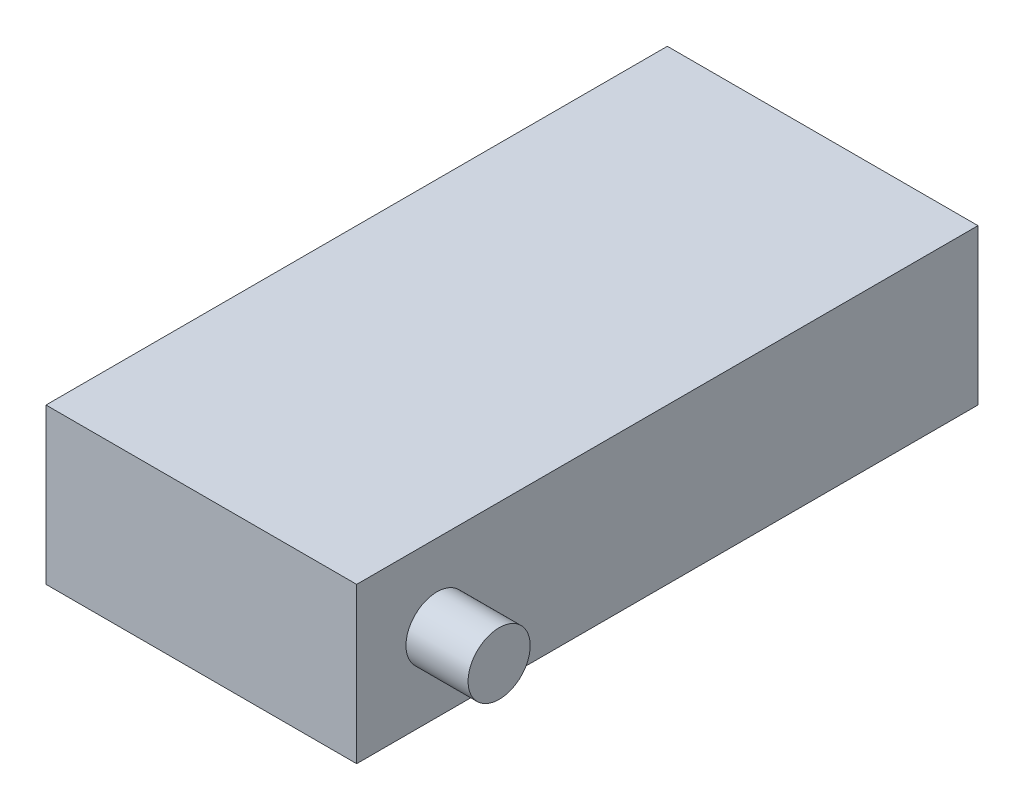
from build123d import *

# Parameters (mm, degrees)
SKETCH1_W           = 40
SKETCH1_H           = 10
BOSS_EXTRUDE1_DEPTH = 20
SKETCH2_R           = 2
BOSS_EXTRUDE2_DEPTH = 4


with BuildPart() as part:
    # Sketch1 → Boss-Extrude1 (new body)
    with BuildSketch(Plane(origin=(0, 0, 0), x_dir=(0, 0, -1), z_dir=(1, 0, 0))):
        with Locations((6.382595331, 3.446369028)):
            Rectangle(SKETCH1_W, SKETCH1_H)
    extrude(amount=BOSS_EXTRUDE1_DEPTH)

    # Sketch2 → Boss-Extrude2 (add)
    with BuildSketch(Plane(origin=(20, 0, 0), x_dir=(0, 0, -1), z_dir=(1, 0, 0))):
        with Locations((-8.44508687, 3.446369028)):
            Circle(SKETCH2_R)
    extrude(amount=BOSS_EXTRUDE2_DEPTH)


solid = part.part
